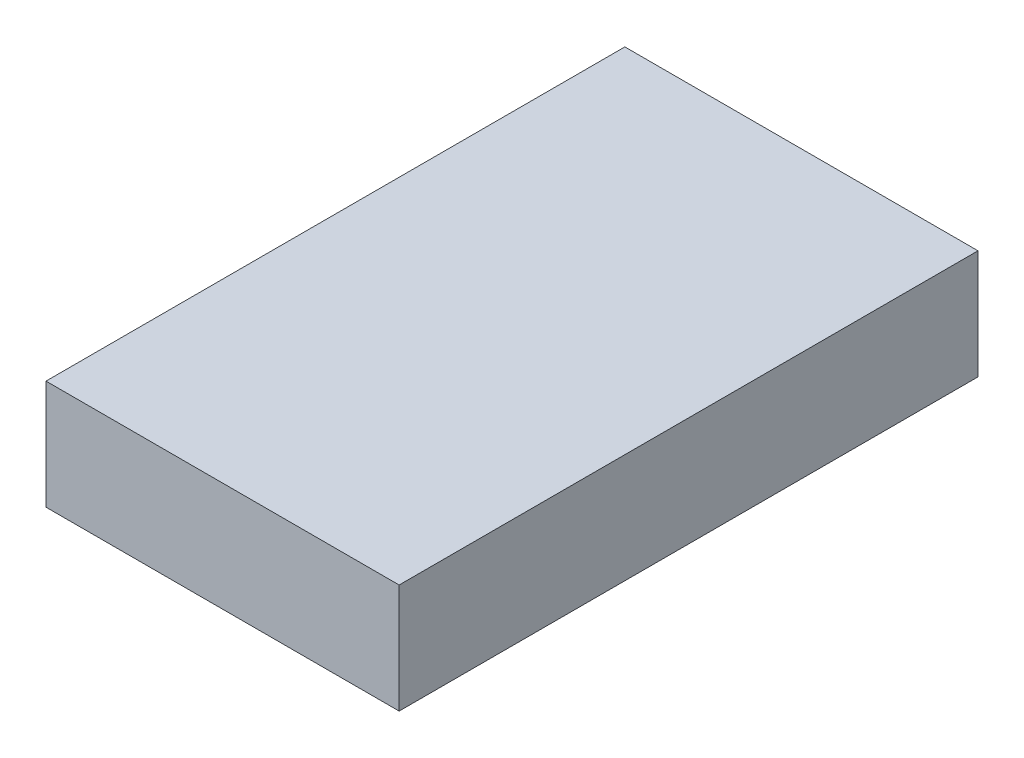
from build123d import *

# Parameters (mm, degrees)
SKETCH1_W           = 97
SKETCH1_H           = 159
BOSS_EXTRUDE1_DEPTH = 30


with BuildPart() as part:
    # Sketch1 → Boss-Extrude1 (new body)
    with BuildSketch(Plane(origin=(0, 0, 0), x_dir=(1, 0, 0), z_dir=(0, 1, 0))):
        Rectangle(SKETCH1_W, SKETCH1_H)
    extrude(amount=BOSS_EXTRUDE1_DEPTH)


solid = part.part
